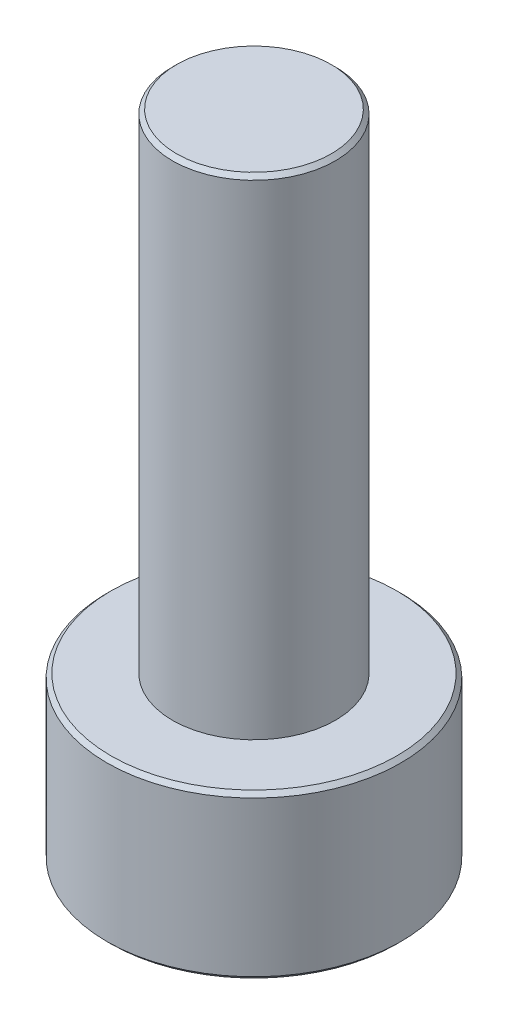
from build123d import *

# Parameters (mm, degrees)
SKETCH_1_R            = 3.61
EXTRUDE_259_DEPTH     = 4
SKETCH_2_R            = 2
EXTRUDE_342_DEPTH     = 12
CUT_EXTRUDE_525_DEPTH = 2
CHAMFER_587_SIZE      = 0.1


with BuildPart() as part:
    # 草图1 → Extrude 259 (new body)
    with BuildSketch(Plane(origin=(0, 0, 0), x_dir=(1, 0, 0), z_dir=(0, 1, 0))):
        with Locations(Location((0, 0, 0), (0, 0, 270))):
            Circle(SKETCH_1_R)
    extrude(amount=EXTRUDE_259_DEPTH)

    # 草图2 → Extrude 342 (add)
    with BuildSketch(Plane(origin=(0, 4, 0), x_dir=(1, 0, 0), z_dir=(0, 1, 0))):
        with Locations(Location((0, 0, 0), (0, 0, 270))):
            Circle(SKETCH_2_R)
    extrude(amount=EXTRUDE_342_DEPTH)

    # 草图3 → Cut-Extrude 525 (cut)
    with BuildSketch(Plane.XZ):
        Polygon((1.54, -0.889119415), (1.54, 0.889119415), (0, 1.778238829), (-1.54, 0.889119415), (-1.54, -0.889119415), (0, -1.778238829), align=None)
    extrude(amount=-CUT_EXTRUDE_525_DEPTH, mode=Mode.SUBTRACT)

    # Chamfer 587
    chamfer_587_edges = [part.edges().sort_by_distance(p)[0] for p in [
        (0, 0, -3.61),
        (0, 4, -3.61),
        (0, 16, -2),
    ]]
    chamfer(chamfer_587_edges, length=CHAMFER_587_SIZE)


solid = part.part
